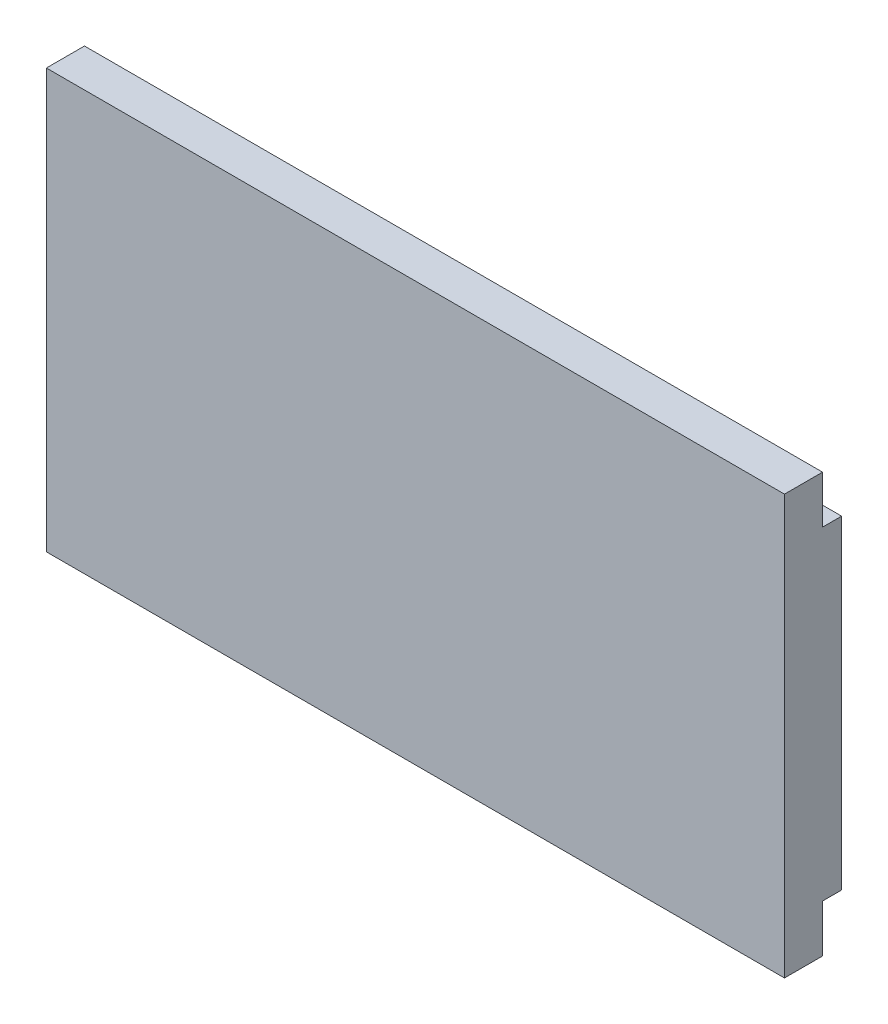
from build123d import *

# Parameters (mm, degrees)
SKETCH_1_W      = 31
SKETCH_1_H      = 17.6
EXTRUDE_1_DEPTH = 1.6
EXTRUDE_2_DEPTH = 0.8


with BuildPart() as part:
    # 草图1 → 凸台-拉伸1 (new body)
    with BuildSketch(Plane.XY):
        Rectangle(SKETCH_1_W, SKETCH_1_H)
    extrude(amount=EXTRUDE_1_DEPTH)

    # 草图2 → 凸台-拉伸2 (add)
    with BuildSketch(Plane(origin=(0, 0, 0), x_dir=(-1, 0, 0), z_dir=(0, 0, -1))):
        Polygon((-13.5, -8.8), (-13.5, -6.8), (-15.5, -6.8), (-15.5, 6.8), (-1, 6.8), (-1, 4.8), (3, 4.8), (3, 6.735183862), (15.5, 6.735183862), (15.5, -6.8), (13.5, -6.8), (13.5, -8.8), align=None)
    extrude(amount=EXTRUDE_2_DEPTH)


solid = part.part
